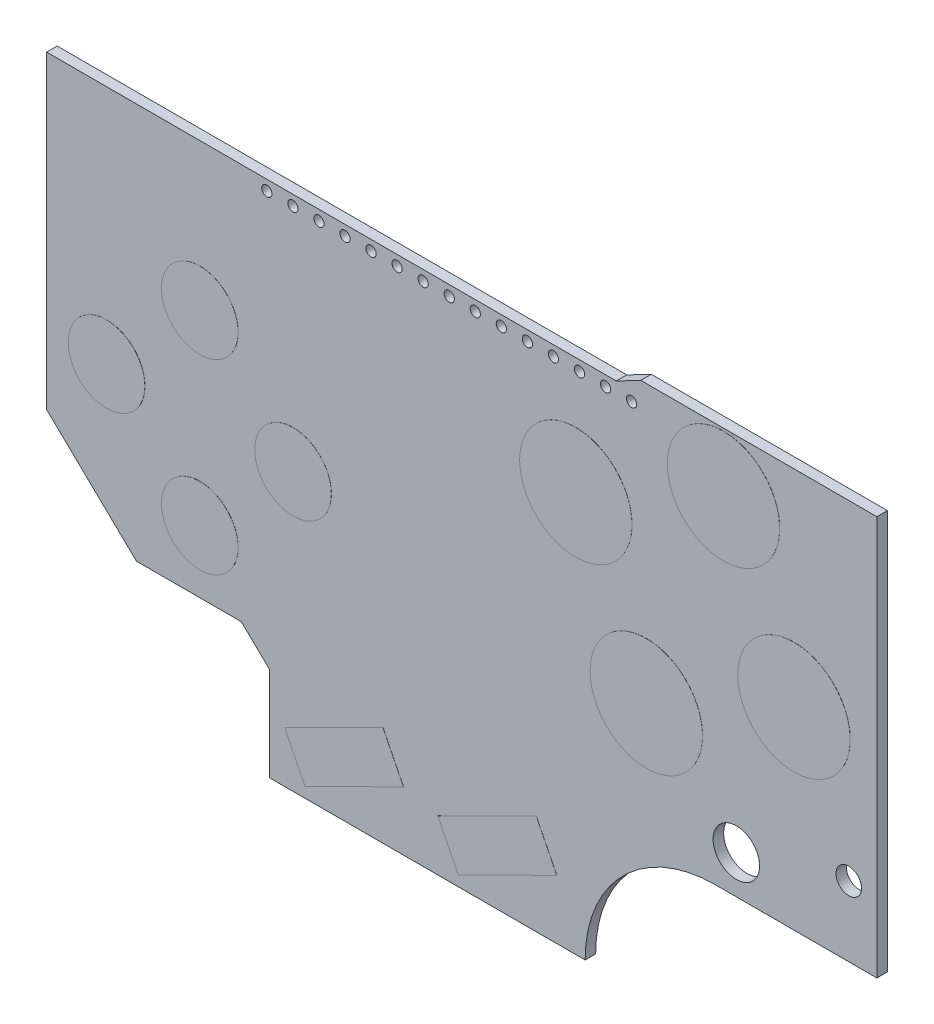
from build123d import *

# Parameters (mm, degrees)
BOSS_EXTRUDE1_DEPTH = 0.515
SKETCH2_R           = 5.5
BOSS_EXTRUDE2_DEPTH = 0.01
SKETCH3_R           = 3.75
BOSS_EXTRUDE5_DEPTH = 0.525
BOSS_EXTRUDE6_DEPTH = 0.01
SKETCH6_R           = 0.5
CUT_EXTRUDE1_DEPTH  = 96.72347361
LPATTERN1_COUNT     = 15
LPATTERN1_PITCH     = 2.55
SKETCH7_R           = 2.275
SKETCH7_R_2         = 1.25
CUT_EXTRUDE2_DEPTH  = 96.72347361


with BuildPart() as part:
    # Sketch1 → Boss-Extrude1 (new, symmetric)
    with BuildSketch(Plane.XY):
        with BuildLine():
            Line((0, 0), (55.75, 0))
            Line((55.75, 0), (58.15, 1.25))
            Line((58.15, 1.25), (81.25, 1.25))
            Line((81.25, 1.25), (81.25, -37.85))
            Line((81.25, -37.85), (65.45, -37.85))
            ThreePointArc((65.45, -37.85), (56.43438854, -41.58438854), (52.7, -50.6))
            Line((52.7, -50.6), (21.8, -50.6))
            Line((21.8, -50.6), (21.8, -41.4))
            Line((21.8, -41.4), (19.042567568, -38.75))
            Line((19.042567568, -38.75), (8.792567568, -38.75))
            Line((8.792567568, -38.75), (0, -30.3))
            Line((0, -30.3), (0, 0))
        make_face()
    extrude(amount=BOSS_EXTRUDE1_DEPTH, both=True)

    # Sketch2 → Boss-Extrude2 (add)
    with BuildSketch(Plane.XY.offset(0.515)):
        with Locations(Location((66.25, -4.5, 0), (0, 0, 180))):
            Circle(SKETCH2_R)
        with Locations(Location((73.15, -18.935719587, 0), (0, 0, 180))):
            Circle(SKETCH2_R)
        with Locations(Location((58.696235763, -25.844344587, 0), (0, 0, 180))):
            Circle(SKETCH2_R)
        with Locations(Location((51.796235763, -11.408625, 0), (0, 0, 180))):
            Circle(SKETCH2_R)
    extrude(amount=BOSS_EXTRUDE2_DEPTH)

    # Sketch3 → Boss-Extrude5 (add, through all)
    with BuildSketch(Plane.XY):
        with Locations((15, -14.375)):
            Circle(SKETCH3_R)
        with Locations((15, -32.625)):
            Circle(SKETCH3_R)
        with Locations((24.125, -23.5)):
            Circle(SKETCH3_R)
        with Locations((5.875, -23.5)):
            Circle(SKETCH3_R)
    extrude(amount=BOSS_EXTRUDE5_DEPTH)

    # Sketch5 → Boss-Extrude6 (add)
    with BuildSketch(Plane.XY.offset(0.515)):
        Polygon((32.918861679, -40.773499762), (23.3, -45.573499762), (25.309302326, -49.6), (34.928164005, -44.8), align=None)
        Polygon((38.3, -45.573499762), (40.309302326, -49.6), (49.928164005, -44.8), (47.918861679, -40.773499762), align=None)
    extrude(amount=BOSS_EXTRUDE6_DEPTH)

    # Sketch6 → Cut-Extrude1 (cut, through all)
    with BuildSketch(Plane.XY.offset(0.515)):
        with Locations((57.25, -1)):
            Circle(SKETCH6_R)
    cut_extrude1 = extrude(amount=-CUT_EXTRUDE1_DEPTH, mode=Mode.SUBTRACT)

    # LPattern1: Cut-Extrude1 ×15
    with Locations(*[(-i * LPATTERN1_PITCH, 0, 0) for i in range(1, LPATTERN1_COUNT)]):
        add(cut_extrude1, mode=Mode.SUBTRACT)

    # Sketch7 → Cut-Extrude2 (cut, through all)
    with BuildSketch(Plane.XY.offset(0.515)):
        with Locations((67.5, -34.1)):
            Circle(SKETCH7_R)
        with Locations((78.5, -31)):
            Circle(SKETCH7_R_2)
    extrude(amount=-CUT_EXTRUDE2_DEPTH, mode=Mode.SUBTRACT)


solid = part.part
